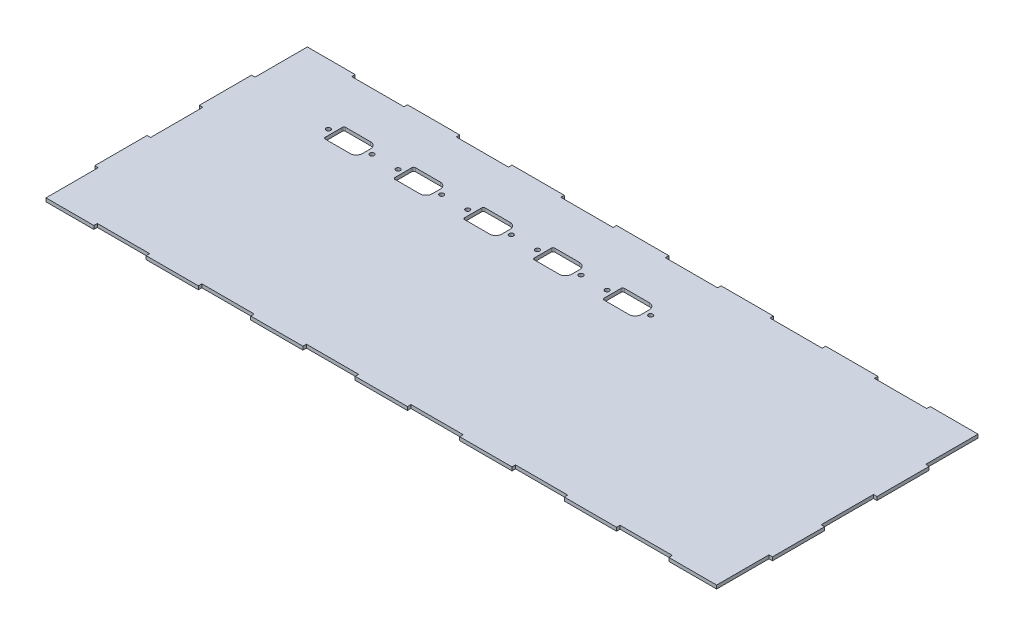
from build123d import *

# Parameters (mm, degrees)
BOSS_EXTRUDE1_DEPTH = 2
SKETCH3_R           = 1.25
CUT_EXTRUDE1_DEPTH  = 2


with BuildPart() as part:
    # Sketch1 → Boss-Extrude1 (new body)
    with BuildSketch(Plane(origin=(0, 0, 0), x_dir=(1, 0, 0), z_dir=(0, 1, 0))):
        Polygon((192.158560219, 82.016387154), (164.708560219, 82.016387154), (164.708560219, 80.016387154), (134.708560219, 80.016387154), (134.708560219, 82.016387154), (104.708560219, 82.016387154), (104.708560219, 80.016387154), (74.708560219, 80.016387154), (74.708560219, 82.016387154), (44.708560219, 82.016387154), (44.708560219, 80.016387154), (14.708560219, 80.016387154), (14.708560219, 82.016387154), (-15.291439781, 82.016387154), (-15.291439781, 80.016387154), (-45.291439781, 80.016387154), (-45.291439781, 82.016387154), (-75.291439781, 82.016387154), (-75.291439781, 80.016387154), (-105.291439781, 80.016387154), (-105.291439781, 82.016387154), (-135.291439781, 82.016387154), (-135.291439781, 80.016387154), (-165.291439781, 80.016387154), (-165.291439781, 82.016387154), (-192.741439781, 82.016387154), (-192.741439781, 80.016387154), (-192.741439781, 52.016387154), (-194.741439781, 52.016387154), (-194.741439781, 22.016387154), (-192.741439781, 22.016387154), (-192.741439781, -7.983612846), (-194.741439781, -7.983612846), (-194.741439781, -37.983612846), (-192.741439781, -37.983612846), (-192.741439781, -65.983612846), (-192.741439781, -67.983612846), (-165.291439781, -67.983612846), (-165.291439781, -65.983612846), (-135.291439781, -65.983612846), (-135.291439781, -67.983612846), (-105.291439781, -67.983612846), (-105.291439781, -65.983612846), (-75.291439781, -65.983612846), (-75.291439781, -67.983612846), (-45.291439781, -67.983612846), (-45.291439781, -65.983612846), (-15.291439781, -65.983612846), (-15.291439781, -67.983612846), (14.708560219, -67.983612846), (14.708560219, -65.983612846), (44.708560219, -65.983612846), (44.708560219, -67.983612846), (74.708560219, -67.983612846), (74.708560219, -65.983612846), (104.708560219, -65.983612846), (104.708560219, -67.983612846), (134.708560219, -67.983612846), (134.708560219, -65.983612846), (164.708560219, -65.983612846), (164.708560219, -67.983612846), (192.158560219, -67.983612846), (192.158560219, -65.983612846), (192.158560219, -37.983612846), (194.158560219, -37.983612846), (194.158560219, -7.983612846), (192.158560219, -7.983612846), (192.158560219, 22.016387154), (194.158560219, 22.016387154), (194.158560219, 52.016387154), (192.158560219, 52.016387154), (192.158560219, 80.016387154), align=None)
    extrude(amount=BOSS_EXTRUDE1_DEPTH)

    # Sketch3 → Cut-Extrude1 (cut)
    with BuildSketch(Plane(origin=(0, 2, 0), x_dir=(1, 0, 0), z_dir=(0, 1, 0))):
        with Locations(Location((-145.841439781, 47.166387154, 0), (0, 0, 270))):
            Circle(SKETCH3_R)
        with Locations(Location((-120.841439781, 47.166387154, 0), (0, 0, 270))):
            Circle(SKETCH3_R)
        with Locations(Location((-105.841439781, 47.166387154, 0), (0, 0, 270))):
            Circle(SKETCH3_R)
        with Locations(Location((-80.841439781, 47.166387154, 0), (0, 0, 270))):
            Circle(SKETCH3_R)
        with Locations(Location((-65.841439781, 47.166387154, 0), (0, 0, 270))):
            Circle(SKETCH3_R)
        with Locations(Location((-40.841439781, 47.166387154, 0), (0, 0, 270))):
            Circle(SKETCH3_R)
        with Locations(Location((-25.841439781, 47.166387154, 0), (0, 0, 270))):
            Circle(SKETCH3_R)
        with Locations(Location((-0.841439781, 47.166387154, 0), (0, 0, 270))):
            Circle(SKETCH3_R)
        with Locations(Location((14.158560219, 47.166387154, 0), (0, 0, 270))):
            Circle(SKETCH3_R)
        with Locations(Location((39.158560219, 47.166387154, 0), (0, 0, 270))):
            Circle(SKETCH3_R)
        with BuildLine():
            Line((-127.466439781, 41.316387154), (-141.741439781, 41.316387154))
            ThreePointArc((-141.741439781, 41.316387154), (-142.448546562, 41.609280373), (-142.741439781, 42.316387154))
            Line((-142.741439781, 42.316387154), (-142.741439781, 52.016387154))
            ThreePointArc((-142.741439781, 52.016387154), (-142.448546562, 52.723493935), (-141.741439781, 53.016387154))
            Line((-141.741439781, 53.016387154), (-127.466439781, 53.016387154))
            ThreePointArc((-127.466439781, 53.016387154), (-124.973888377, 51.983938557), (-123.941439781, 49.491387154))
            Line((-123.941439781, 49.491387154), (-123.941439781, 44.841387154))
            ThreePointArc((-123.941439781, 44.841387154), (-124.973888377, 42.34883575), (-127.466439781, 41.316387154))
        make_face()
        with BuildLine():
            Line((-87.466439781, 41.316387154), (-101.741439781, 41.316387154))
            ThreePointArc((-101.741439781, 41.316387154), (-102.448546562, 41.609280373), (-102.741439781, 42.316387154))
            Line((-102.741439781, 42.316387154), (-102.741439781, 52.016387154))
            ThreePointArc((-102.741439781, 52.016387154), (-102.448546562, 52.723493935), (-101.741439781, 53.016387154))
            Line((-101.741439781, 53.016387154), (-87.466439781, 53.016387154))
            ThreePointArc((-87.466439781, 53.016387154), (-84.973888377, 51.983938557), (-83.941439781, 49.491387154))
            Line((-83.941439781, 49.491387154), (-83.941439781, 44.841387154))
            ThreePointArc((-83.941439781, 44.841387154), (-84.973888377, 42.34883575), (-87.466439781, 41.316387154))
        make_face()
        with BuildLine():
            Line((-47.466439781, 41.316387154), (-61.741439781, 41.316387154))
            ThreePointArc((-61.741439781, 41.316387154), (-62.448546562, 41.609280373), (-62.741439781, 42.316387154))
            Line((-62.741439781, 42.316387154), (-62.741439781, 52.016387154))
            ThreePointArc((-62.741439781, 52.016387154), (-62.448546562, 52.723493935), (-61.741439781, 53.016387154))
            Line((-61.741439781, 53.016387154), (-47.466439781, 53.016387154))
            ThreePointArc((-47.466439781, 53.016387154), (-44.973888377, 51.983938557), (-43.941439781, 49.491387154))
            Line((-43.941439781, 49.491387154), (-43.941439781, 44.841387154))
            ThreePointArc((-43.941439781, 44.841387154), (-44.973888377, 42.34883575), (-47.466439781, 41.316387154))
        make_face()
        with BuildLine():
            Line((-7.466439781, 41.316387154), (-21.741439781, 41.316387154))
            ThreePointArc((-21.741439781, 41.316387154), (-22.448546562, 41.609280373), (-22.741439781, 42.316387154))
            Line((-22.741439781, 42.316387154), (-22.741439781, 52.016387154))
            ThreePointArc((-22.741439781, 52.016387154), (-22.448546562, 52.723493935), (-21.741439781, 53.016387154))
            Line((-21.741439781, 53.016387154), (-7.466439781, 53.016387154))
            ThreePointArc((-7.466439781, 53.016387154), (-4.973888377, 51.983938557), (-3.941439781, 49.491387154))
            Line((-3.941439781, 49.491387154), (-3.941439781, 44.841387154))
            ThreePointArc((-3.941439781, 44.841387154), (-4.973888377, 42.34883575), (-7.466439781, 41.316387154))
        make_face()
        with BuildLine():
            Line((32.533560219, 41.316387154), (18.258560219, 41.316387154))
            ThreePointArc((18.258560219, 41.316387154), (17.551453438, 41.609280373), (17.258560219, 42.316387154))
            Line((17.258560219, 42.316387154), (17.258560219, 52.016387154))
            ThreePointArc((17.258560219, 52.016387154), (17.551453438, 52.723493935), (18.258560219, 53.016387154))
            Line((18.258560219, 53.016387154), (32.533560219, 53.016387154))
            ThreePointArc((32.533560219, 53.016387154), (35.026111623, 51.983938557), (36.058560219, 49.491387154))
            Line((36.058560219, 49.491387154), (36.058560219, 44.841387154))
            ThreePointArc((36.058560219, 44.841387154), (35.026111623, 42.34883575), (32.533560219, 41.316387154))
        make_face()
    extrude(amount=-CUT_EXTRUDE1_DEPTH, mode=Mode.SUBTRACT)


solid = part.part
